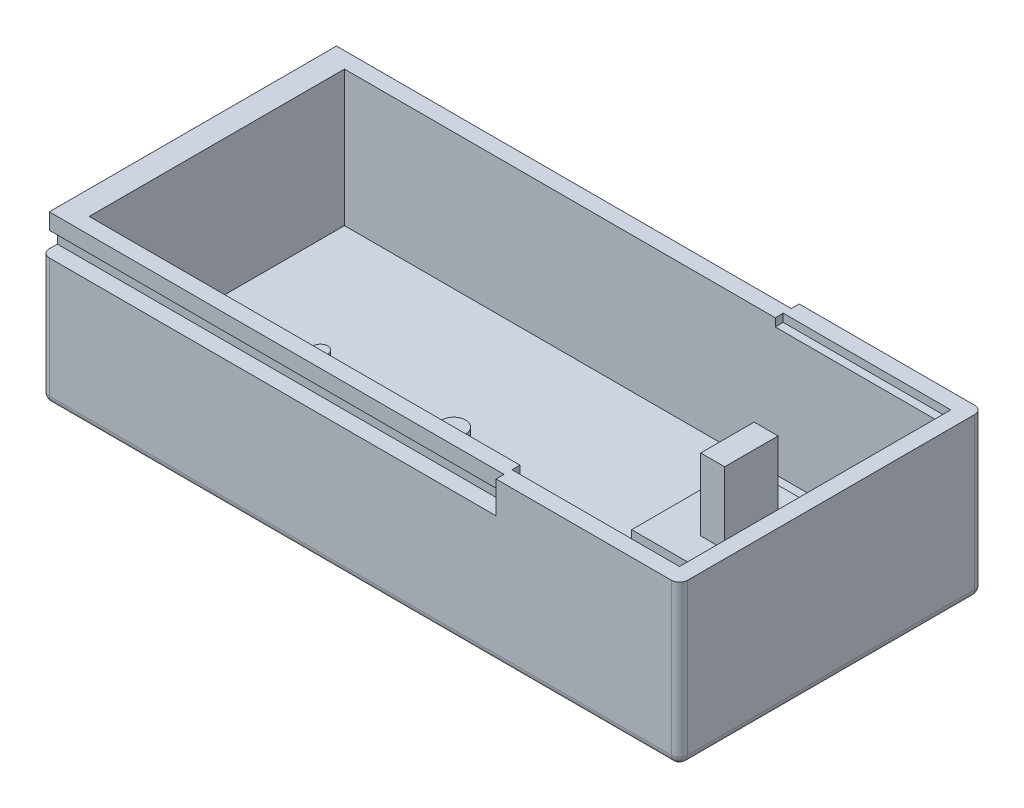
from build123d import *

# Parameters (mm, degrees)
SKETCH1_W           = 80
SKETCH1_H           = 38
BOSS_EXTRUDE1_DEPTH = 12
FILLET1_R           = 1
SKETCH3_W           = 57
SKETCH3_H           = 38
CUT_EXTRUDE1_DEPTH  = 4
SHELL1_T            = -3
CUT_EXTRUDE2_DEPTH  = 57
SKETCH5_R           = 0.9
SKETCH5_R_2         = 1.5
BOSS_EXTRUDE2_DEPTH = 1
SKETCH6_W           = 23
SKETCH6_H           = 38
CUT_EXTRUDE3_DEPTH  = 4
SKETCH7_W           = 9.5
SKETCH7_H           = 14
BOSS_EXTRUDE3_DEPTH = 8
SKETCH9_W           = 21
SKETCH9_H           = 34
CUT_EXTRUDE6_DEPTH  = 1
SKETCH8_W           = 3
SKETCH8_H           = 6.7
BOSS_EXTRUDE4_DEPTH = 9
CUT_EXTRUDE7_REACH  = 49.434
SKETCH10_R          = 1
SKETCH11_R          = 2
CUT_EXTRUDE8_DEPTH  = 2


with BuildPart() as part:
    # Sketch1 → Boss-Extrude1 (new, symmetric)
    with BuildSketch(Plane(origin=(0, 0, 0), x_dir=(1, 0, 0), z_dir=(0, 1, 0))):
        Rectangle(SKETCH1_W, SKETCH1_H)
    extrude(amount=BOSS_EXTRUDE1_DEPTH, both=True)

    # Fillet1
    fillet1_edges = [part.edges().sort_by_distance(p)[0] for p in [
        (-40, 12, 0),
        (0, 12, 19),
        (40, 12, 0),
        (0, -12, 19),
        (-40, -12, 0),
        (0, -12, -19),
        (40, -12, 0),
        (0, 12, -19),
        (40, 0, 19),
        (-40, 0, 19),
        (-40, 0, -19),
        (40, 0, -19),
    ]]
    fillet(fillet1_edges, radius=FILLET1_R)

    # Sketch3 → Cut-Extrude1 (cut)
    with BuildSketch(Plane(origin=(0, 12, 0), x_dir=(1, 0, 0), z_dir=(0, 1, 0))):
        with Locations((-11.5, 0)):
            Rectangle(SKETCH3_W, SKETCH3_H)
    extrude(amount=-CUT_EXTRUDE1_DEPTH, mode=Mode.SUBTRACT)

    # Shell1
    shell1_openings = [part.faces().sort_by_distance(p)[0] for p in [
        (17, 9.994969103, 0),
        (-11.494395734, 8, 0),
    ]]
    offset(amount=SHELL1_T, openings=shell1_openings, kind=Kind.INTERSECTION)

    # Sketch4 → Cut-Extrude2 (cut)
    with BuildSketch(Plane.ZY.offset(40)):
        Polygon((-18, 8), (-19, 8), (-19, 4), (-18, 4), (-17, 4), (-17, 6), (-18, 6), align=None)
    cut_extrude2 = extrude(amount=-CUT_EXTRUDE2_DEPTH, mode=Mode.SUBTRACT)

    # Mirror1: Cut-Extrude2 across plane
    add(cut_extrude2.mirror(Plane.XY), mode=Mode.SUBTRACT)

    # Sketch5 → Boss-Extrude2 (add)
    with BuildSketch(Plane(origin=(0, -9, 0), x_dir=(1, 0, 0), z_dir=(0, 1, 0))):
        with Locations(Location((-24, 0, 0), (0, 0, 270))):
            Circle(SKETCH5_R)
        with Locations(Location((-7.3, 0, 0), (0, 0, 270))):
            Circle(SKETCH5_R_2)
    extrude(amount=BOSS_EXTRUDE2_DEPTH)

    # Sketch6 → Cut-Extrude3 (cut)
    with BuildSketch(Plane(origin=(0, 12, 0), x_dir=(1, 0, 0), z_dir=(0, 1, 0))):
        with Locations((28.5, 0)):
            Rectangle(SKETCH6_W, SKETCH6_H)
    extrude(amount=-CUT_EXTRUDE3_DEPTH, mode=Mode.SUBTRACT)

    # Sketch7 → Boss-Extrude3 (add)
    with BuildSketch(Plane(origin=(0, -9, 0), x_dir=(1, 0, 0), z_dir=(0, 1, 0))):
        with Locations((26.75, 0)):
            Rectangle(SKETCH7_W, SKETCH7_H)
    extrude(amount=BOSS_EXTRUDE3_DEPTH)

    # Sketch9 → Cut-Extrude6 (cut)
    with BuildSketch(Plane(origin=(0, 8, 0), x_dir=(1, 0, 0), z_dir=(0, 1, 0))):
        with Locations((27.5, 0)):
            Rectangle(SKETCH9_W, SKETCH9_H)
    extrude(amount=-CUT_EXTRUDE6_DEPTH, mode=Mode.SUBTRACT)

    # Sketch8 → Boss-Extrude4 (add)
    with BuildSketch(Plane(origin=(0, -1, 0), x_dir=(1, 0, 0), z_dir=(0, 1, 0))):
        with Locations((28.5, 0)):
            Rectangle(SKETCH8_W, SKETCH8_H)
    extrude(amount=BOSS_EXTRUDE4_DEPTH)

    # Sketch10 → Cut-Extrude7 (cut, up to next)
    with BuildSketch(Plane(origin=(0, -9, 0), x_dir=(1, 0, 0), z_dir=(0, 1, 0)), mode=Mode.PRIVATE) as cut_extrude7_sk1:
        with Locations(Location((28.5, 11, 0), (0, 0, 270))):
            Circle(SKETCH10_R)
    cut_extrude7_tool1 = extrude(cut_extrude7_sk1.sketch, amount=-CUT_EXTRUDE7_REACH, mode=Mode.PRIVATE) & part.part
    # Sketch10 → Cut-Extrude7 (cut, up to next)
    with BuildSketch(Plane(origin=(0, -9, 0), x_dir=(1, 0, 0), z_dir=(0, 1, 0)), mode=Mode.PRIVATE) as cut_extrude7_sk2:
        with Locations(Location((28.5, -11, 0), (0, 0, 270))):
            Circle(SKETCH10_R)
    cut_extrude7_tool2 = extrude(cut_extrude7_sk2.sketch, amount=-CUT_EXTRUDE7_REACH, mode=Mode.PRIVATE) & part.part
    add(cut_extrude7_tool1.solids().sort_by_distance((28.5, -9, -11))[0], mode=Mode.SUBTRACT)
    add(cut_extrude7_tool2.solids().sort_by_distance((28.5, -9, 11))[0], mode=Mode.SUBTRACT)

    # Sketch11 → Cut-Extrude8 (cut)
    with BuildSketch(Plane.XZ.offset(12)):
        with Locations(Location((28.5, -11, 0), (0, 0, 270))):
            Circle(SKETCH11_R)
        with Locations(Location((28.5, 11, 0), (0, 0, 270))):
            Circle(SKETCH11_R)
    extrude(amount=-CUT_EXTRUDE8_DEPTH, mode=Mode.SUBTRACT)


solid = part.part
